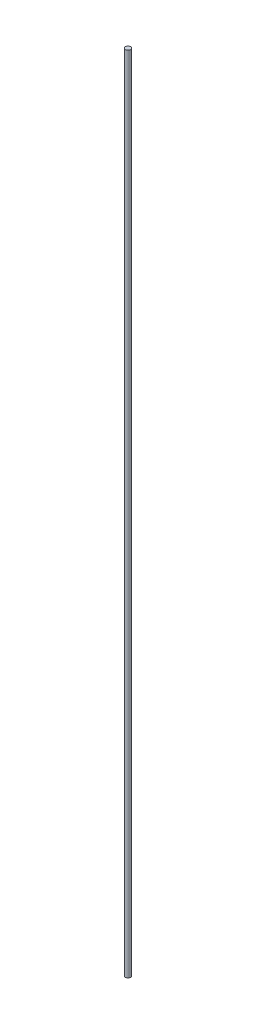
from build123d import *

# Parameters (mm, degrees)
SWEEP1_PROFILE_R = 6.35


with BuildPart() as part:
    # Sweep1: sweep along a path in Sketch1
    with BuildLine(Plane.XY) as sweep1_path:
        Line((0, 0), (0, 1968.246))
    # Sweep1 profile (on start of the path) → Sweep1 (sweep)
    with BuildSketch(Plane.ZX):
        Circle(SWEEP1_PROFILE_R)
    sweep(path=sweep1_path.line)


solid = part.part
